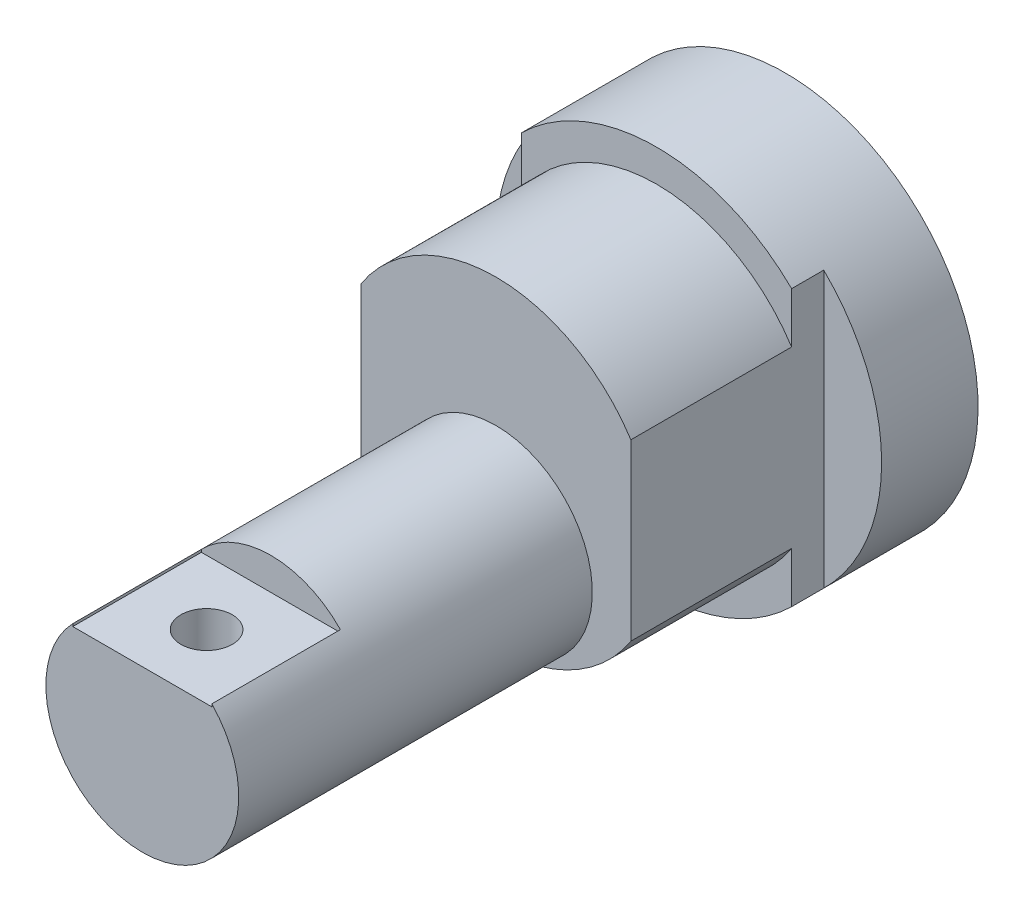
from build123d import *

# Parameters (mm, degrees)
IZIM1_R                     = 15
Y_KSEKLIK_EKSTR_ZYON1_DEPTH = 55
IZIM2_R                     = 25
Y_KSEKLIK_EKSTR_ZYON2_DEPTH = 25
IZIM3_R                     = 30
Y_KSEKLIK_EKSTR_ZYON3_DEPTH = 20
IZIM4_W                     = 21.622627276
IZIM4_H                     = 20
KES_EKSTR_ZYON1_DEPTH       = 20
IZIM6_R                     = 4
KES_EKSTR_ZYON2_DEPTH       = 30
KES_EKSTR_ZYON3_DEPTH       = 30


with BuildPart() as part:
    # Çizim1 → Yükseklik-Ekstrüzyon1 (new body)
    with BuildSketch(Plane.XY):
        Circle(IZIM1_R)
    extrude(amount=-Y_KSEKLIK_EKSTR_ZYON1_DEPTH)

    # Çizim2 → Yükseklik-Ekstrüzyon2 (add)
    with BuildSketch(Plane(origin=(0, 0, -55), x_dir=(-1, 0, 0), z_dir=(0, 0, -1))):
        with Locations(Location((0, 10, 0), (0, 0, 270))):
            Circle(IZIM2_R)
    extrude(amount=Y_KSEKLIK_EKSTR_ZYON2_DEPTH)

    # Çizim3 → Yükseklik-Ekstrüzyon3 (add)
    with BuildSketch(Plane(origin=(0, 0, -80), x_dir=(-1, 0, 0), z_dir=(0, 0, -1))):
        with Locations((0, 10)):
            Circle(IZIM3_R)
    extrude(amount=Y_KSEKLIK_EKSTR_ZYON3_DEPTH)

    # Çizim4 → Kes-Ekstrüzyon1 (cut)
    with BuildSketch(Plane(origin=(0, 10, 0), x_dir=(1, 0, 0), z_dir=(0, 1, 0))):
        with Locations((0, 10)):
            Rectangle(IZIM4_W, IZIM4_H)
    extrude(amount=KES_EKSTR_ZYON1_DEPTH, mode=Mode.SUBTRACT)

    # Çizim6 → Kes-Ekstrüzyon2 (cut)
    with BuildSketch(Plane(origin=(0, 10, 0), x_dir=(1, 0, 0), z_dir=(0, 1, 0))):
        with Locations(Location((0, 10, 0), (0, 0, 270))):
            Circle(IZIM6_R)
    extrude(amount=-KES_EKSTR_ZYON2_DEPTH, mode=Mode.SUBTRACT)

    # Çizim7 → Kes-Ekstrüzyon3 (cut)
    with BuildSketch(Plane(origin=(21, 0, 0), x_dir=(0, 0, -1), z_dir=(1, 0, 0))):
        Polygon((55, -7.517008245), (80, -7.517008245), (80, -20), (85, -20), (85, 40), (80, 40), (80, 25), (55, 25), align=None)
    kes_ekstr_zyon3 = extrude(amount=KES_EKSTR_ZYON3_DEPTH, mode=Mode.SUBTRACT)

    # Aynalama1: Kes-Ekstrüzyon3 across plane
    add(kes_ekstr_zyon3.mirror(Plane(origin=(0, 0, 0), x_dir=(0, 0, 1), z_dir=(1, 0, 0))), mode=Mode.SUBTRACT)


solid = part.part
